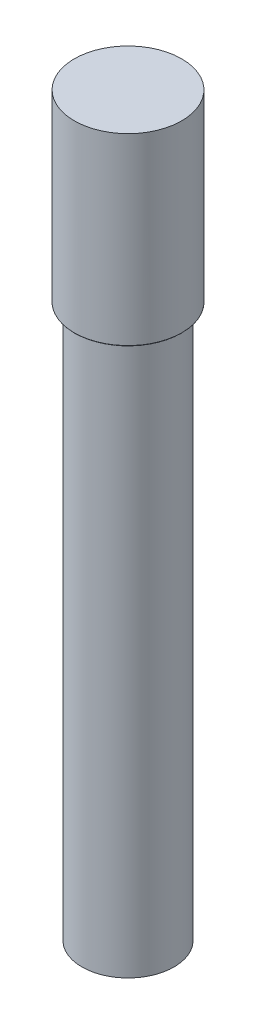
from build123d import *

# Parameters (mm, degrees)
SKETCH2_R           = 19.05
BOSS_EXTRUDE1_DEPTH = 228.6
SKETCH3_R           = 22.225
BOSS_EXTRUDE2_DEPTH = 76.2
FILLET1_R           = 0.254


with BuildPart() as part:
    # Sketch2 → Boss-Extrude1 (new body)
    with BuildSketch(Plane(origin=(0, 0, 0), x_dir=(1, 0, 0), z_dir=(0, 1, 0))):
        with Locations(Location((0, 0, 0), (0, 0, 270))):
            Circle(SKETCH2_R)
    extrude(amount=BOSS_EXTRUDE1_DEPTH)

    # Sketch3 → Boss-Extrude2 (add)
    with BuildSketch(Plane(origin=(0, 228.6, 0), x_dir=(1, 0, 0), z_dir=(0, 1, 0))):
        with Locations(Location((0, 0, 0), (0, 0, 90))):
            Circle(SKETCH3_R)
    extrude(amount=BOSS_EXTRUDE2_DEPTH)

    # Fillet1
    fillet1_edges = [part.edges().sort_by_distance(p)[0] for p in [
        (0, 228.6, -19.05),
        (0, 228.6, 22.225),
    ]]
    fillet(fillet1_edges, radius=FILLET1_R)


solid = part.part
